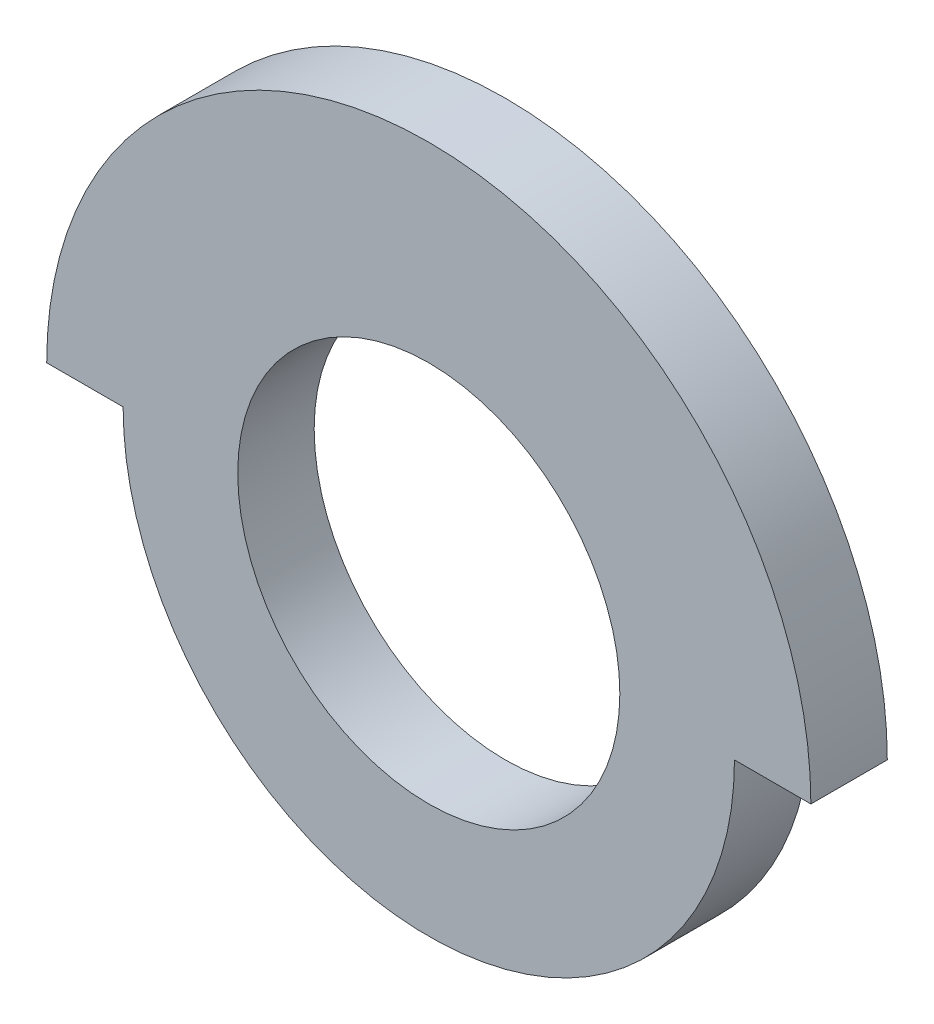
from build123d import *

# Parameters (mm, degrees)
SKETCH1_R           = 5
BOSS_EXTRUDE1_DEPTH = 2


with BuildPart() as part:
    # Sketch1 → Boss-Extrude1 (new body)
    with BuildSketch(Plane.XY):
        with BuildLine():
            Line((-10, 0), (-8, 0))
            ThreePointArc((-8, 0), (0, -8), (8, 0))
            Line((8, 0), (10, 0))
            ThreePointArc((10, 0), (0, 10), (-10, 0))
        make_face()
        Circle(SKETCH1_R, mode=Mode.SUBTRACT)
    extrude(amount=BOSS_EXTRUDE1_DEPTH)


solid = part.part
